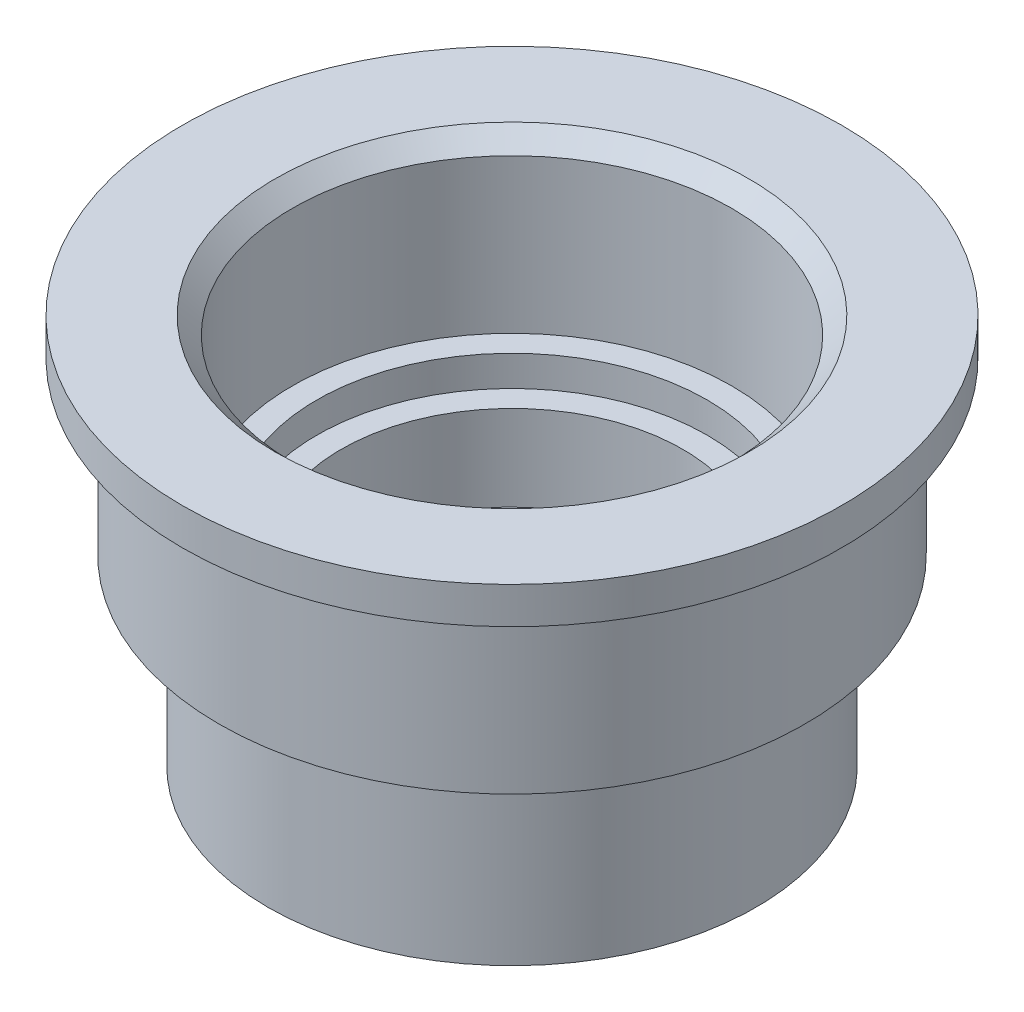
from build123d import *

# Parameters (mm, degrees)
ESQUISSE2_R             = 10
BOSS_EXTRU_1_DEPTH      = 7.5
ESQUISSE3_R             = 12
BOSS_EXTRU_2_DEPTH      = 7
ESQUISSE4_R             = 13.5
BOSS_EXTRU_3_DEPTH      = 1.5
ESQUISSE7_R             = 5.5
ENL_V_MAT_EXTRU_1_DEPTH = 21.5
ESQUISSE8_R             = 9
ENL_V_MAT_EXTRU_2_DEPTH = 7
CHANFREIN1_SIZE         = 0.7
ESQUISSE9_R             = 8
ENL_V_MAT_EXTRU_3_DEPTH = 1.25
ESQUISSE10_R            = 7
ENL_V_MAT_EXTRU_4_DEPTH = 3.5


with BuildPart() as part:
    # Esquisse2 → Boss.-Extru.1 (new body)
    with BuildSketch(Plane(origin=(0, 0, 0), x_dir=(1, 0, 0), z_dir=(0, 1, 0))):
        with Locations(Location((0, 0, 0), (0, 0, 270))):
            Circle(ESQUISSE2_R)
    extrude(amount=BOSS_EXTRU_1_DEPTH)

    # Esquisse3 → Boss.-Extru.2 (add)
    with BuildSketch(Plane(origin=(0, 7.5, 0), x_dir=(1, 0, 0), z_dir=(0, 1, 0))):
        with Locations(Location((0, 0, 0), (0, 0, 270))):
            Circle(ESQUISSE3_R)
    extrude(amount=BOSS_EXTRU_2_DEPTH)

    # Esquisse4 → Boss.-Extru.3 (add)
    with BuildSketch(Plane(origin=(0, 14.5, 0), x_dir=(1, 0, 0), z_dir=(0, 1, 0))):
        with Locations(Location((0, 0, 0), (0, 0, 270))):
            Circle(ESQUISSE4_R)
    extrude(amount=BOSS_EXTRU_3_DEPTH)

    # Esquisse7 → Enlèv. mat.-Extru.1 (cut)
    with BuildSketch(Plane.XZ):
        with Locations(Location((0, 0, 0), (0, 0, 270))):
            Circle(ESQUISSE7_R)
    extrude(amount=-ENL_V_MAT_EXTRU_1_DEPTH, mode=Mode.SUBTRACT)

    # Esquisse8 → Enlèv. mat.-Extru.2 (cut)
    with BuildSketch(Plane(origin=(0, 16, 0), x_dir=(1, 0, 0), z_dir=(0, 1, 0))):
        with Locations(Location((0, 0, 0), (0, 0, 270))):
            Circle(ESQUISSE8_R)
    extrude(amount=-ENL_V_MAT_EXTRU_2_DEPTH, mode=Mode.SUBTRACT)

    # Chanfrein1
    chanfrein1_edges = [part.edges().sort_by_distance(p)[0] for p in [
        (0, 16, -9),
    ]]
    chamfer(chanfrein1_edges, length=CHANFREIN1_SIZE)

    # Esquisse9 → Enlèv. mat.-Extru.3 (cut)
    with BuildSketch(Plane(origin=(0, 9, 0), x_dir=(1, 0, 0), z_dir=(0, 1, 0))):
        with Locations(Location((0, 0, 0), (0, 0, 270))):
            Circle(ESQUISSE9_R)
    extrude(amount=-ENL_V_MAT_EXTRU_3_DEPTH, mode=Mode.SUBTRACT)

    # Esquisse10 → Enlèv. mat.-Extru.4 (cut)
    with BuildSketch(Plane(origin=(0, 7.75, 0), x_dir=(1, 0, 0), z_dir=(0, 1, 0))):
        with Locations(Location((0, 0, 0), (0, 0, 270))):
            Circle(ESQUISSE10_R)
    extrude(amount=-ENL_V_MAT_EXTRU_4_DEPTH, mode=Mode.SUBTRACT)


solid = part.part
